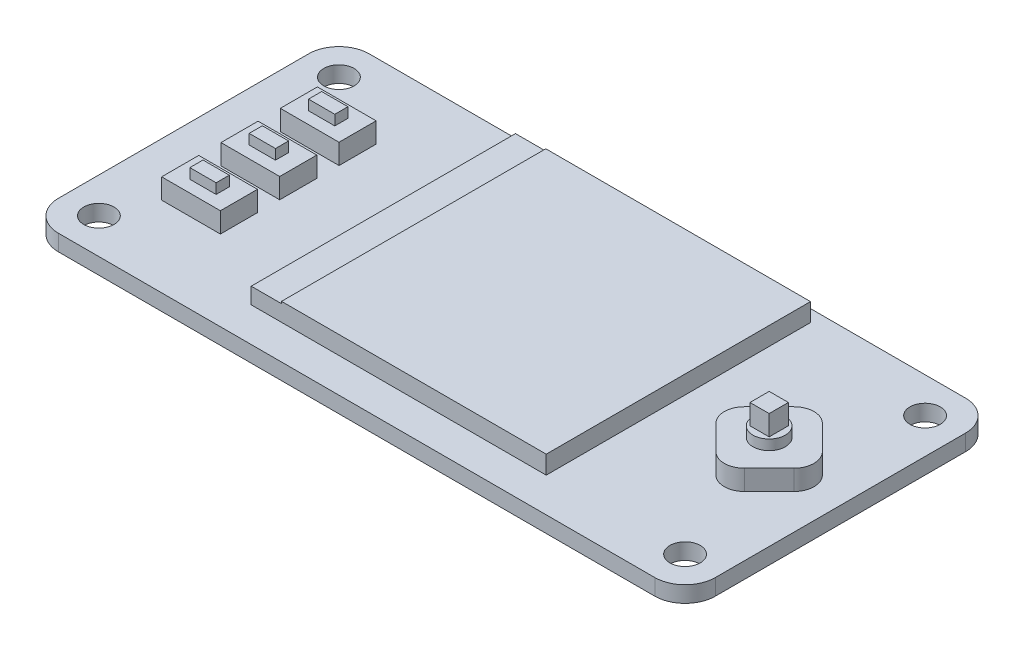
from build123d import *

# Parameters (mm, degrees)
EXTRUDE_1_DEPTH     = 1.6
SKETCH_2_R          = 1.5
CUT_EXTRUDE_1_DEPTH = 1.6
SKETCH_3_W          = 29.19
SKETCH_3_H          = 26.15
EXTRUDE_2_DEPTH     = 1.8
EXTRUDE_3_DEPTH     = 2
SKETCH_6_W          = 3
SKETCH_6_H          = 26.15
CUT_EXTRUDE_2_DEPTH = 0.2
SKETCH_4_W          = 5.81
SKETCH_4_H          = 3.67
EXTRUDE_4_DEPTH     = 2
SKETCH_7_W          = 2.6
SKETCH_7_H          = 1.3
EXTRUDE_5_DEPTH     = 1
SKETCH_8_W          = 51
SKETCH_8_H          = 5
EXTRUDE_6_DEPTH     = 3.68
SKETCH_9_W          = 1.9
SKETCH_9_H          = 1.9
EXTRUDE_7_DEPTH     = 3
SKETCH_10_R         = 1.6
EXTRUDE_8_DEPTH     = 1


with BuildPart() as part:
    # 草图1 → 凸台-拉伸1 (new body)
    with BuildSketch(Plane(origin=(0, 0, 0), x_dir=(1, 0, 0), z_dir=(0, 1, 0))):
        with BuildLine():
            Line((-29.5, 15.375), (29.5, 15.375))
            ThreePointArc((29.5, 15.375), (31.621320344, 14.496320344), (32.5, 12.375))
            Line((32.5, 12.375), (32.5, -12.375))
            ThreePointArc((32.5, -12.375), (31.621320344, -14.496320344), (29.5, -15.375))
            Line((29.5, -15.375), (-29.5, -15.375))
            ThreePointArc((-29.5, -15.375), (-31.621320344, -14.496320344), (-32.5, -12.375))
            Line((-32.5, -12.375), (-32.5, 12.375))
            ThreePointArc((-32.5, 12.375), (-31.621320344, 14.496320344), (-29.5, 15.375))
        make_face()
    extrude(amount=EXTRUDE_1_DEPTH)

    # 草图2 → 切除-拉伸1 (cut)
    with BuildSketch(Plane(origin=(0, 1.6, 0), x_dir=(1, 0, 0), z_dir=(0, 1, 0))):
        with Locations(Location((-29, 11.875, 0), (0, 0, 270))):
            Circle(SKETCH_2_R)
        with Locations(Location((-29, -11.875, 0), (0, 0, 270))):
            Circle(SKETCH_2_R)
        with Locations(Location((29, -11.875, 0), (0, 0, 270))):
            Circle(SKETCH_2_R)
        with Locations(Location((29, 11.875, 0), (0, 0, 270))):
            Circle(SKETCH_2_R)
    extrude(amount=-CUT_EXTRUDE_1_DEPTH, mode=Mode.SUBTRACT)

    # 草图3 → 凸台-拉伸2 (add)
    with BuildSketch(Plane(origin=(0, 1.6, 0), x_dir=(1, 0, 0), z_dir=(0, 1, 0))):
        with Locations((0.765, 1.1)):
            Rectangle(SKETCH_3_W, SKETCH_3_H)
    extrude(amount=EXTRUDE_2_DEPTH)

    # 草图5 → 凸台-拉伸3 (add)
    with BuildSketch(Plane(origin=(0, 1.6, 0), x_dir=(1, 0, 0), z_dir=(0, 1, 0))):
        with BuildLine():
            Line((26.574695167, 4.138250353), (29.014213562, 1.698731957))
            ThreePointArc((29.014213562, 1.698731957), (29.6, 0.284518395), (29.014213562, -1.129695167))
            Line((29.014213562, -1.129695167), (26.574695167, -3.569213562))
            ThreePointArc((26.574695167, -3.569213562), (25.160481605, -4.155), (23.746268043, -3.569213562))
            Line((23.746268043, -3.569213562), (21.306749647, -1.129695167))
            ThreePointArc((21.306749647, -1.129695167), (20.72096321, 0.284518395), (21.306749647, 1.698731957))
            Line((21.306749647, 1.698731957), (23.746268043, 4.138250353))
            ThreePointArc((23.746268043, 4.138250353), (25.160481605, 4.72403679), (26.574695167, 4.138250353))
        make_face()
    extrude(amount=EXTRUDE_3_DEPTH)

    # 草图6 → 切除-拉伸2 (cut)
    with BuildSketch(Plane(origin=(0, 3.4, 0), x_dir=(1, 0, 0), z_dir=(0, 1, 0))):
        with Locations((-12.33, 1.1)):
            Rectangle(SKETCH_6_W, SKETCH_6_H)
    extrude(amount=-CUT_EXTRUDE_2_DEPTH, mode=Mode.SUBTRACT)

    # 草图4 → 凸台-拉伸4 (add)
    with BuildSketch(Plane(origin=(0, 1.6, 0), x_dir=(1, 0, 0), z_dir=(0, 1, 0))):
        with Locations((-24.325, 6.14)):
            Rectangle(SKETCH_4_W, SKETCH_4_H)
        with Locations((-24.325, 0.27)):
            Rectangle(SKETCH_4_W, SKETCH_4_H)
        with Locations((-24.325, -5.6)):
            Rectangle(SKETCH_4_W, SKETCH_4_H)
    extrude(amount=EXTRUDE_4_DEPTH)

    # 草图7 → 凸台-拉伸5 (add)
    with BuildSketch(Plane(origin=(0, 3.6, 0), x_dir=(1, 0, 0), z_dir=(0, 1, 0))):
        with Locations((-24.325, 6.14)):
            Rectangle(SKETCH_7_W, SKETCH_7_H)
        with Locations((-24.325, 0.27)):
            Rectangle(SKETCH_7_W, SKETCH_7_H)
        with Locations((-24.325, -5.6)):
            Rectangle(SKETCH_7_W, SKETCH_7_H)
    extrude(amount=EXTRUDE_5_DEPTH)

    # 草图8 → 凸台-拉伸6 (add)
    with BuildSketch(Plane.XZ):
        with Locations((-0.2, -11.235)):
            Rectangle(SKETCH_8_W, SKETCH_8_H)
    extrude(amount=EXTRUDE_6_DEPTH)

    # 草图9 → 凸台-拉伸7 (add)
    with BuildSketch(Plane(origin=(0, 3.6, 0), x_dir=(1, 0, 0), z_dir=(0, 1, 0))):
        with Locations((25.160481605, 0.284518395)):
            Rectangle(SKETCH_9_W, SKETCH_9_H)
    extrude(amount=EXTRUDE_7_DEPTH)

    # 草图10 → 凸台-拉伸8 (add)
    with BuildSketch(Plane(origin=(0, 3.6, 0), x_dir=(1, 0, 0), z_dir=(0, 1, 0))):
        with Locations(Location((25.160481605, 0.284518395, 0), (0, 0, 90))):
            Circle(SKETCH_10_R)
    extrude(amount=EXTRUDE_8_DEPTH)


solid = part.part
